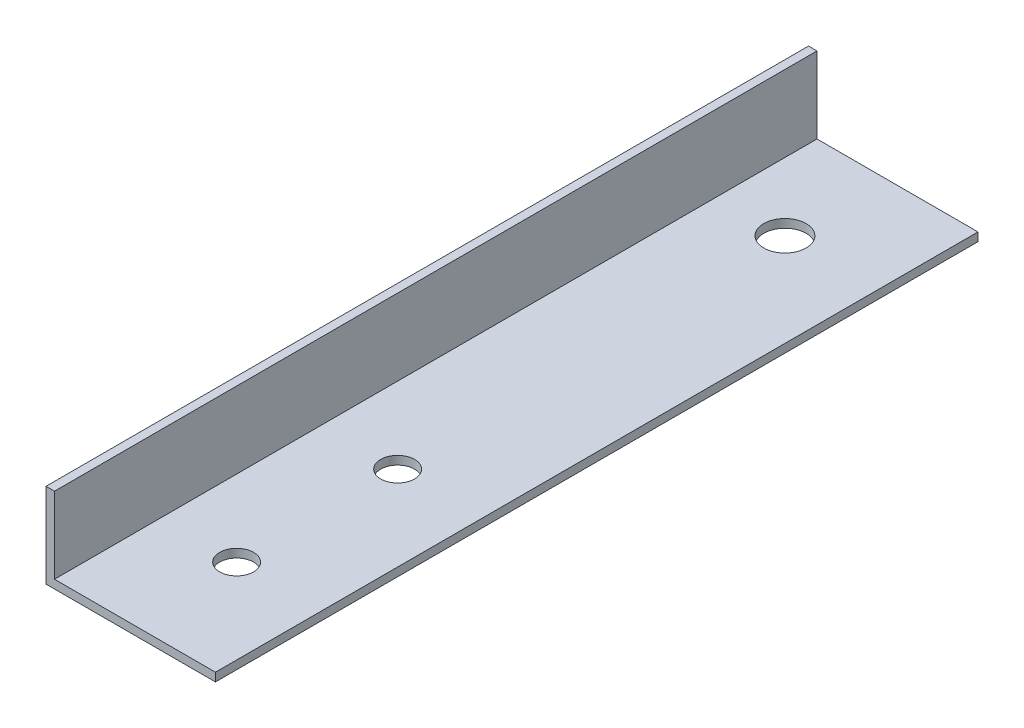
from build123d import *

# Parameters (mm, degrees)
BOSS_EXTRUDE1_DEPTH = 180
SKETCH4_R           = 4
SKETCH4_R_2         = 5
CUT_EXTRUDE5_DEPTH  = 10


with BuildPart() as part:
    # Sketch1 → Boss-Extrude1 (new body)
    with BuildSketch(Plane.XY):
        Polygon((-69.579831933, 29.327731092), (-67.579831933, 29.327731092), (-67.579831933, 11.327731092), (-29.579831933, 11.327731092), (-29.579831933, 9.327731092), (-69.579831933, 9.327731092), (-69.579831933, 11.327731092), align=None)
    extrude(amount=BOSS_EXTRUDE1_DEPTH)

    # Sketch4 → Cut-Extrude5 (cut)
    with BuildSketch(Plane.XZ.offset(-9.327731092)):
        with Locations(Location((-49.579831933, 155, 0), (0, 0, 270))):
            Circle(SKETCH4_R)
        with Locations(Location((-49.579831933, 117, 0), (0, 0, 270))):
            Circle(SKETCH4_R)
        with Locations(Location((-51.579831933, 23.57405489, 0), (0, 0, 270))):
            Circle(SKETCH4_R_2)
    extrude(amount=-CUT_EXTRUDE5_DEPTH, mode=Mode.SUBTRACT)


solid = part.part
